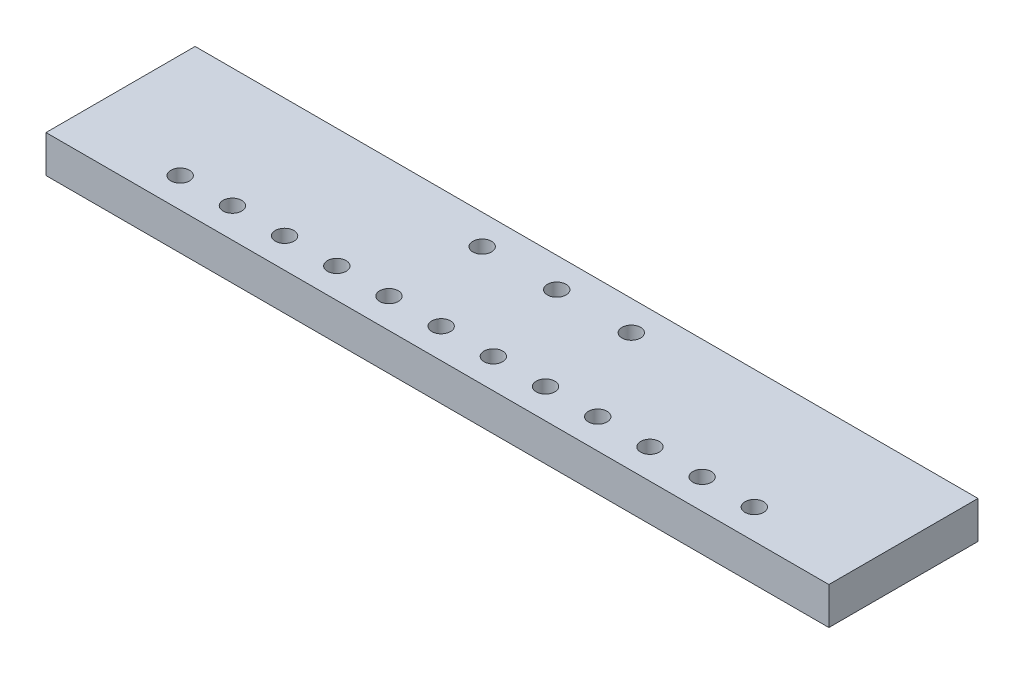
from build123d import *

# Parameters (mm, degrees)
SKETCH1_W           = 133.35
SKETCH1_H           = 25.4
BOSS_EXTRUDE1_DEPTH = 6.35
SKETCH2_R           = 1.5875
CUT_EXTRUDE1_DEPTH  = 6.35


with BuildPart() as part:
    # Sketch1 → Boss-Extrude1 (new body)
    with BuildSketch(Plane(origin=(0, 0, 0), x_dir=(1, 0, 0), z_dir=(0, 1, 0))):
        Rectangle(SKETCH1_W, SKETCH1_H)
    extrude(amount=BOSS_EXTRUDE1_DEPTH)

    # Sketch2 → Cut-Extrude1 (cut)
    with BuildSketch(Plane(origin=(0, 6.35, 0), x_dir=(1, 0, 0), z_dir=(0, 1, 0))):
        with Locations(Location((0, 7.62, 0), (0, 0, 270))):
            Circle(SKETCH2_R)
        with Locations(Location((-12.7, 7.62, 0), (0, 0, 270))):
            Circle(SKETCH2_R)
        with Locations(Location((12.7, 7.62, 0), (0, 0, 270))):
            Circle(SKETCH2_R)
        with Locations(Location((-48.895, -7.62, 0), (0, 0, 270))):
            Circle(SKETCH2_R)
        with Locations(Location((-40.005, -7.62, 0), (0, 0, 270))):
            Circle(SKETCH2_R)
        with Locations(Location((-31.115, -7.62, 0), (0, 0, 270))):
            Circle(SKETCH2_R)
        with Locations(Location((-13.335, -7.62, 0), (0, 0, 270))):
            Circle(SKETCH2_R)
        with Locations(Location((-22.225, -7.62, 0), (0, 0, 270))):
            Circle(SKETCH2_R)
        with Locations(Location((-4.445, -7.62, 0), (0, 0, 270))):
            Circle(SKETCH2_R)
        with Locations(Location((4.445, -7.62, 0), (0, 0, 270))):
            Circle(SKETCH2_R)
        with Locations(Location((13.335, -7.62, 0), (0, 0, 270))):
            Circle(SKETCH2_R)
        with Locations(Location((22.225, -7.62, 0), (0, 0, 270))):
            Circle(SKETCH2_R)
        with Locations(Location((31.115, -7.62, 0), (0, 0, 270))):
            Circle(SKETCH2_R)
        with Locations(Location((40.005, -7.62, 0), (0, 0, 270))):
            Circle(SKETCH2_R)
        with Locations(Location((48.895, -7.62, 0), (0, 0, 270))):
            Circle(SKETCH2_R)
    extrude(amount=-CUT_EXTRUDE1_DEPTH, mode=Mode.SUBTRACT)


solid = part.part
